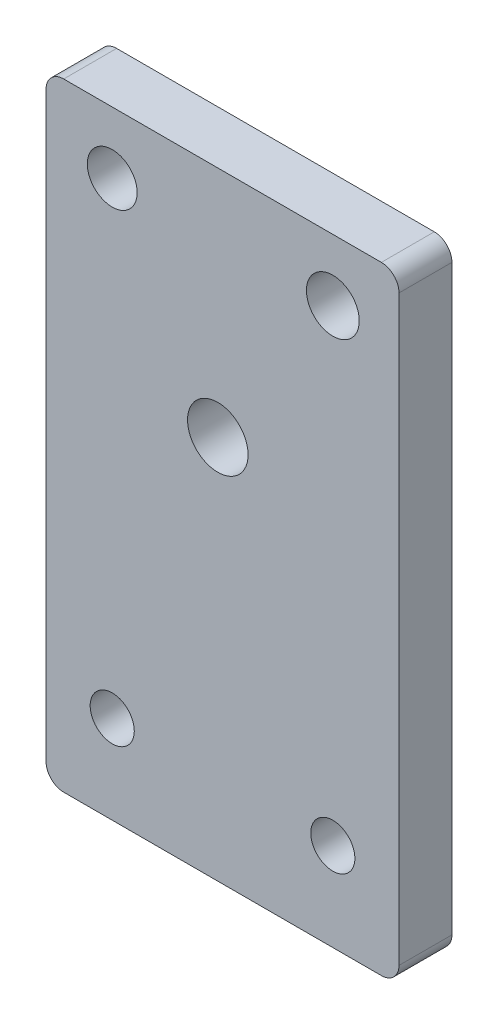
from build123d import *

# Parameters (mm, degrees)
SKETCH1_R           = 2.824114624
SKETCH1_R_2         = 2.992549833
SKETCH1_R_3         = 2.5
SKETCH1_R_4         = 3.43104669
BOSS_EXTRUDE1_DEPTH = 6


with BuildPart() as part:
    # Sketch1 → Boss-Extrude1 (new body)
    with BuildSketch(Plane.XY):
        with BuildLine():
            Line((-7.937888199, 18.260869565), (28.062111801, 18.260869565))
            ThreePointArc((28.062111801, 18.260869565), (29.476325364, 17.675083128), (30.062111801, 16.260869565))
            Line((30.062111801, 16.260869565), (30.062111801, -49.739130435))
            ThreePointArc((30.062111801, -49.739130435), (29.476325364, -51.153343997), (28.062111801, -51.739130435))
            Line((28.062111801, -51.739130435), (-7.937888199, -51.739130435))
            ThreePointArc((-7.937888199, -51.739130435), (-9.352101761, -51.153343997), (-9.937888199, -49.739130435))
            Line((-9.937888199, -49.739130435), (-9.937888199, 16.260869565))
            ThreePointArc((-9.937888199, 16.260869565), (-9.352101761, 17.675083128), (-7.937888199, 18.260869565))
        make_face()
        with Locations((-2.437888199, 11.260869565)):
            Circle(SKETCH1_R, mode=Mode.SUBTRACT)
        with Locations((22.562111801, 11.260869565)):
            Circle(SKETCH1_R_2, mode=Mode.SUBTRACT)
        with Locations((-2.437888199, -41.739130435)):
            Circle(SKETCH1_R_3, mode=Mode.SUBTRACT)
        with Locations((22.562111801, -41.739130435)):
            Circle(SKETCH1_R_3, mode=Mode.SUBTRACT)
        with Locations((9.525913043, -8.176621118)):
            Circle(SKETCH1_R_4, mode=Mode.SUBTRACT)
    extrude(amount=BOSS_EXTRUDE1_DEPTH)


solid = part.part
